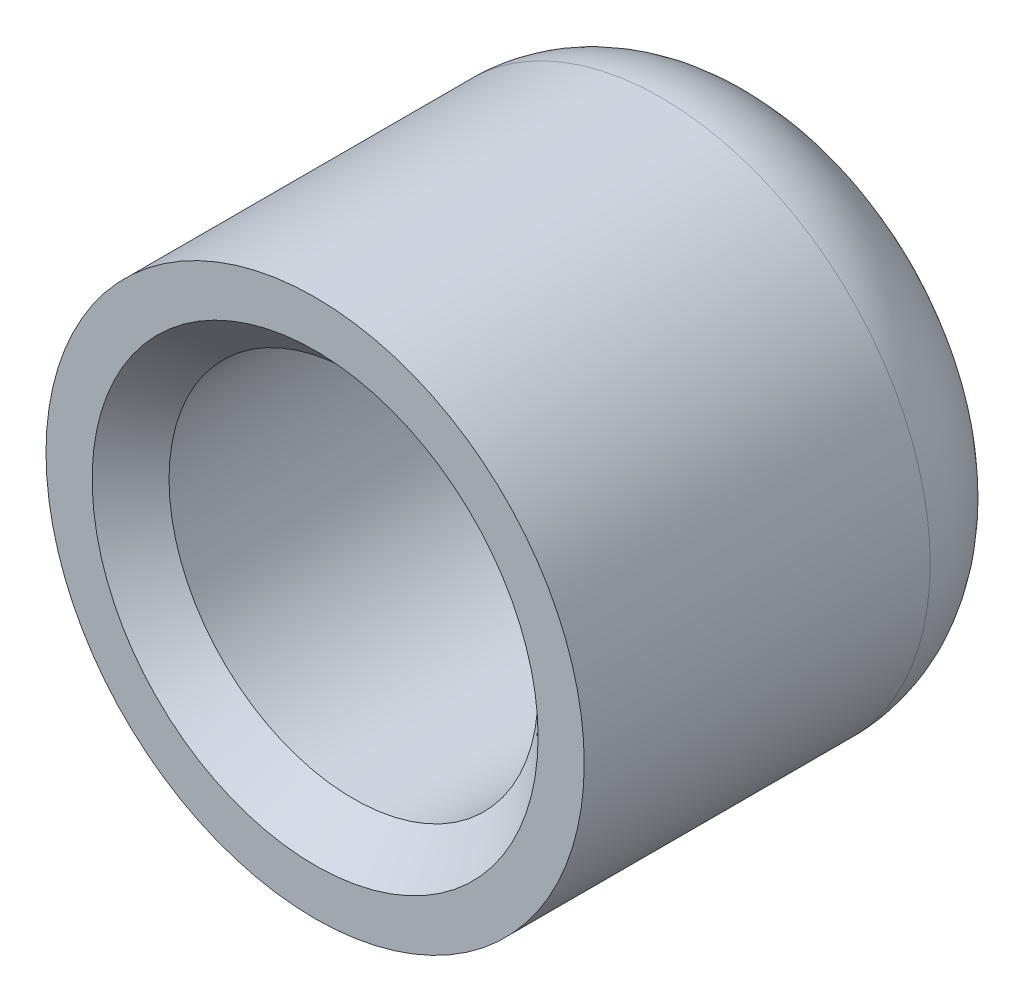
from build123d import *

# Parameters (mm, degrees)
SKETCH1_R           = 3.5
SKETCH1_R_2         = 2.4
BOSS_EXTRUDE1_DEPTH = 6
SKETCH1_2_R         = 2.4
BOSS_EXTRUDE2_DEPTH = 1
FILLET1_R           = 1.5
CHAMFER1_SIZE       = 0.5


with BuildPart() as part:
    # Sketch1 → Boss-Extrude1 (new body)
    with BuildSketch(Plane.XY):
        Circle(SKETCH1_R)
        Circle(SKETCH1_R_2, mode=Mode.SUBTRACT)
    extrude(amount=BOSS_EXTRUDE1_DEPTH)

    # Sketch1<2> → Boss-Extrude2 (add)
    with BuildSketch(Plane.XY):
        Circle(SKETCH1_2_R)
    extrude(amount=BOSS_EXTRUDE2_DEPTH)

    # Fillet1
    fillet1_edges = [part.edges().sort_by_distance(p)[0] for p in [
        (-3.5, 0, 0),
    ]]
    fillet(fillet1_edges, radius=FILLET1_R)

    # Chamfer1
    chamfer1_edges = [part.edges().sort_by_distance(p)[0] for p in [
        (-2.4, 0, 6),
    ]]
    chamfer(chamfer1_edges, length=CHAMFER1_SIZE)


solid = part.part
